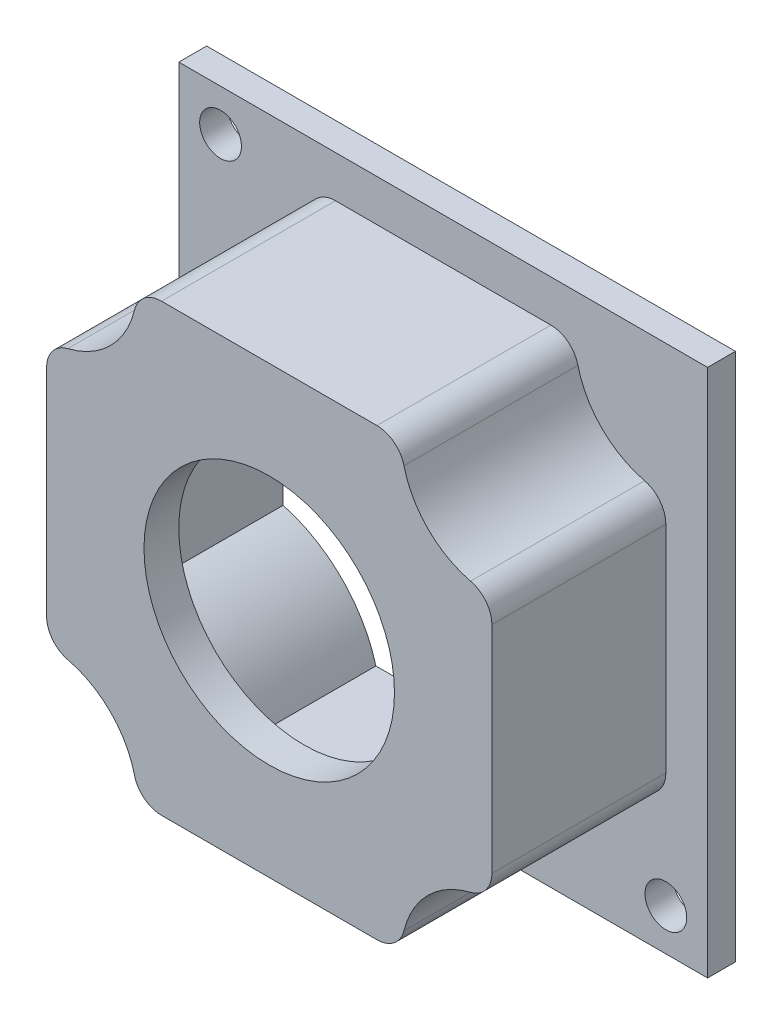
from build123d import *

# Parameters (mm, degrees)
SKETCH1_W           = 38
SKETCH1_H           = 38
BOSS_EXTRUDE1_DEPTH = 2
SKETCH2_R           = 1.5
CUT_EXTRUDE1_DEPTH  = 27.944387171
BOSS_EXTRUDE2_DEPTH = 12.5
SKETCH4_R           = 9
CUT_EXTRUDE2_DEPTH  = 31.532769282
CUT_EXTRUDE3_START  = -2.5
CUT_EXTRUDE3_DEPTH  = 29.032769282
FILLET1_R           = 2


with BuildPart() as part:
    # Sketch1 → Boss-Extrude1 (new body)
    with BuildSketch(Plane(origin=(0, 0, 0), x_dir=(0, 1, 0), z_dir=(0, 0, 1))):
        Rectangle(SKETCH1_W, SKETCH1_H)
    extrude(amount=BOSS_EXTRUDE1_DEPTH)

    # Sketch2 → Cut-Extrude1 (cut, through all)
    with BuildSketch(Plane(origin=(0, 0, 0), x_dir=(1, 0, 0), z_dir=(0, 0, -1))):
        with Locations(Location((-16, 16, 0), (0, 0, 180))):
            Circle(SKETCH2_R)
        with Locations((-16, -16)):
            Circle(SKETCH2_R)
        with Locations((16, 16)):
            Circle(SKETCH2_R)
    extrude(amount=-CUT_EXTRUDE1_DEPTH, mode=Mode.SUBTRACT)

    # Sketch3 → Boss-Extrude2 (add)
    with BuildSketch(Plane.XY.offset(2)):
        with BuildLine():
            Line((-16, 9.5), (-16, -9.5))
            ThreePointArc((-16, -9.5), (-11.403805922, -11.403805922), (-9.5, -16))
            Line((-9.5, -16), (9.5, -16))
            ThreePointArc((9.5, -16), (11.403805922, -11.403805922), (16, -9.5))
            Line((16, -9.5), (16, 9.5))
            ThreePointArc((16, 9.5), (11.403805922, 11.403805922), (9.5, 16))
            Line((9.5, 16), (-9.5, 16))
            ThreePointArc((-9.5, 16), (-11.403805922, 11.403805922), (-16, 9.5))
        make_face()
    extrude(amount=BOSS_EXTRUDE2_DEPTH)

    # Sketch4 → Cut-Extrude2 (cut, through all)
    with BuildSketch(Plane.XY.offset(14.5)):
        Circle(SKETCH4_R)
    extrude(amount=-CUT_EXTRUDE2_DEPTH, mode=Mode.SUBTRACT)

    # Sketch5 → Cut-Extrude3 (cut, through all)
    with BuildSketch(Plane.XY.offset(14.5).offset(CUT_EXTRUDE3_START)):
        with BuildLine():
            Line((-13.5, -6.83484861), (-13.5, 6.83484861))
            ThreePointArc((-13.5, 6.83484861), (-9.282485579, 9.282485579), (-6.83484861, 13.5))
            Line((-6.83484861, 13.5), (6.83484861, 13.5))
            ThreePointArc((6.83484861, 13.5), (9.282485579, 9.282485579), (13.5, 6.83484861))
            Line((13.5, 6.83484861), (13.5, -6.83484861))
            ThreePointArc((13.5, -6.83484861), (9.282485579, -9.282485579), (6.83484861, -13.5))
            Line((6.83484861, -13.5), (-6.83484861, -13.5))
            ThreePointArc((-6.83484861, -13.5), (-9.282485579, -9.282485579), (-13.5, -6.83484861))
        make_face()
    extrude(amount=-CUT_EXTRUDE3_DEPTH, mode=Mode.SUBTRACT)

    # Fillet1
    fillet1_edges = [part.edges().sort_by_distance(p)[0] for p in [
        (-9.5, 16, 8.25),
        (-16, 9.5, 8.25),
        (-16, -9.5, 8.25),
        (-9.5, -16, 8.25),
        (9.5, -16, 8.25),
        (16, -9.5, 8.25),
        (16, 9.5, 8.25),
        (9.5, 16, 8.25),
    ]]
    fillet(fillet1_edges, radius=FILLET1_R)


solid = part.part
